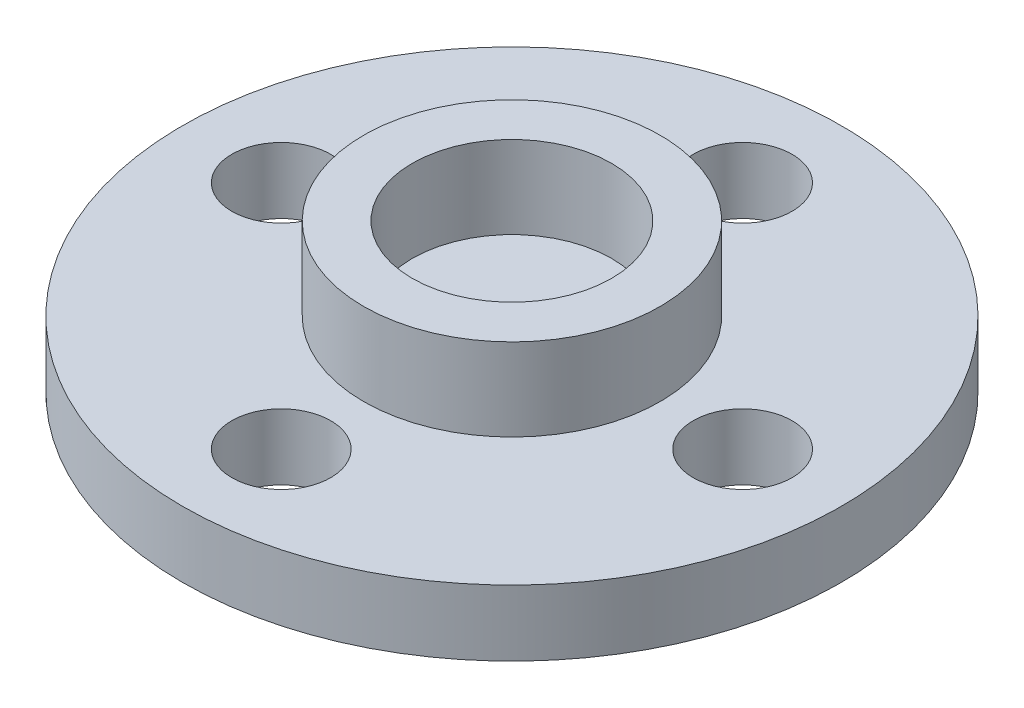
from build123d import *

# Parameters (mm, degrees)
CROQUIS1_R                        = 10
SALIENTE_EXTRUIR1_DEPTH           = 2
CROQUIS2_R                        = 4.5
SALIENTE_EXTRUIR2_DEPTH           = 2.5
DI_METRO_DE_TALADRO_3_0_3_1_D     = 3
DI_METRO_DE_TALADRO_3_0_3_1_DEPTH = 50
DI_METRO_DE_TALADRO_3_0_3_1_TIP   = 0.901290929
CROQUIS5_R                        = 3.025
CORTAR_EXTRUIR1_DEPTH             = 2.5


with BuildPart() as part:
    # Croquis1 → Saliente-Extruir1 (new body)
    with BuildSketch(Plane(origin=(0, 0, 0), x_dir=(1, 0, 0), z_dir=(0, 1, 0))):
        with Locations(Location((0, 0, 0), (0, 0, 270))):
            Circle(CROQUIS1_R)
    extrude(amount=SALIENTE_EXTRUIR1_DEPTH)

    # Croquis2 → Saliente-Extruir2 (add)
    with BuildSketch(Plane(origin=(0, 2, 0), x_dir=(1, 0, 0), z_dir=(0, 1, 0))):
        with Locations(Location((0, 0, 0), (0, 0, 270))):
            Circle(CROQUIS2_R)
    extrude(amount=SALIENTE_EXTRUIR2_DEPTH)

    # Diámetro de taladro Ø3.0 (3)1
    with Locations(Plane(origin=(0, 2, 0), x_dir=(1, 0, 0), z_dir=(0, 1, 0))):
        with Locations((0, 7), (-7, 0), (7, 0), (0, -7)):
            Hole(DI_METRO_DE_TALADRO_3_0_3_1_D / 2, depth=DI_METRO_DE_TALADRO_3_0_3_1_DEPTH)
            with Locations((0, 0, -(DI_METRO_DE_TALADRO_3_0_3_1_DEPTH + DI_METRO_DE_TALADRO_3_0_3_1_TIP / 2))):  # 118° drill point
                Cone(0, DI_METRO_DE_TALADRO_3_0_3_1_D / 2, DI_METRO_DE_TALADRO_3_0_3_1_TIP, mode=Mode.SUBTRACT)

    # Croquis5 → Cortar-Extruir1 (cut)
    with BuildSketch(Plane(origin=(0, 4.5, 0), x_dir=(1, 0, 0), z_dir=(0, 1, 0))):
        with Locations(Location((0, 0, 0), (0, 0, 270))):
            Circle(CROQUIS5_R)
    extrude(amount=-CORTAR_EXTRUIR1_DEPTH, mode=Mode.SUBTRACT)


solid = part.part
